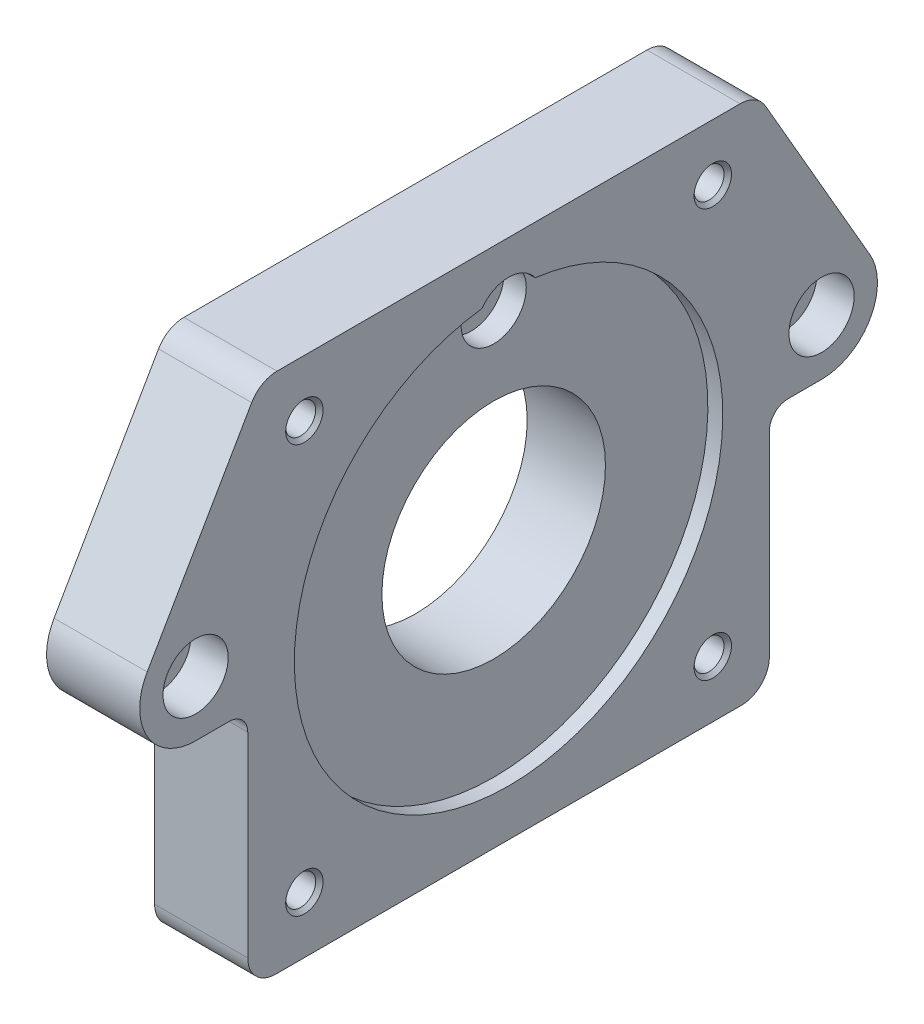
from build123d import *

# Parameters (mm, degrees)
SKETCH1_R                                        = 19.05
BOSS_EXTRUDE1_DEPTH                              = 15.875
FILLET2_R                                        = 3.175
FILLET3_R                                        = 4.7752
SKETCH6_R                                        = 36.5099981
CUT_EXTRUDE2_DEPTH                               = 2.54
CBORE_FOR_1_4_SOCKET_HEAD_CAP_SCREW1_D           = 6.5278
CBORE_FOR_1_4_SOCKET_HEAD_CAP_SCREW1_CBORE_D     = 11.1125
CBORE_FOR_1_4_SOCKET_HEAD_CAP_SCREW1_CBORE_DEPTH = 6.35
F_1_4_20_TAPPED_HOLE1_D                          = 5.1054
F_1_4_20_TAPPED_HOLE1_DEPTH                      = 19.05
F_1_4_20_TAPPED_HOLE1_CSINK_D                    = 6.3754
F_1_4_20_TAPPED_HOLE1_CSINK_ANGLE                = 90
F_1_4_20_TAPPED_HOLE1_TIP                        = 1.533816902


with BuildPart() as part:
    # Sketch1 → Boss-Extrude1 (new body)
    with BuildSketch(Plane(origin=(0, 0, 0), x_dir=(0, 0, -1), z_dir=(1, 0, 0))):
        with BuildLine():
            Line((-39.461181898, 44.45), (39.461181898, 44.45))
            ThreePointArc((39.461181898, 44.45), (41.955590949, 43.781625109), (43.781625109, 41.955590949))
            Line((43.781625109, 41.955590949), (61.588891971, 11.1125))
            ThreePointArc((61.588891971, 11.1125), (61.588891971, 1.5875), (53.34, -3.175))
            Line((53.34, -3.175), (44.45, -3.175))
            Line((44.45, -3.175), (44.45, -44.45))
            Line((44.45, -44.45), (-44.45, -44.45))
            Line((-44.45, -44.45), (-44.45, -3.175))
            Line((-44.45, -3.175), (-53.34, -3.175))
            ThreePointArc((-53.34, -3.175), (-61.588891971, 1.5875), (-61.588891971, 11.1125))
            Line((-61.588891971, 11.1125), (-43.781625109, 41.955590949))
            ThreePointArc((-43.781625109, 41.955590949), (-41.955590949, 43.781625109), (-39.461181898, 44.45))
        make_face()
        Circle(SKETCH1_R, mode=Mode.SUBTRACT)
    extrude(amount=BOSS_EXTRUDE1_DEPTH)

    # Fillet2
    fillet2_edges = [part.edges().sort_by_distance(p)[0] for p in [
        (7.9375, -3.175, 44.45),
        (7.9375, -3.175, -44.45),
    ]]
    fillet(fillet2_edges, radius=FILLET2_R)

    # Fillet3
    fillet3_edges = [part.edges().sort_by_distance(p)[0] for p in [
        (7.9375, -44.45, 44.45),
        (7.9375, -44.45, -44.45),
    ]]
    fillet(fillet3_edges, radius=FILLET3_R)

    # Sketch6 → Cut-Extrude2 (cut)
    with BuildSketch(Plane(origin=(15.875, 0, 0), x_dir=(0, 0, -1), z_dir=(1, 0, 0))):
        Circle(SKETCH6_R)
    extrude(amount=-CUT_EXTRUDE2_DEPTH, mode=Mode.SUBTRACT)

    # CBORE for 1/4 Socket Head Cap Screw1 (through all)
    with Locations(Plane(origin=(15.875, 0, 0), x_dir=(0, 0, -1), z_dir=(1, 0, 0))):
        with Locations((-53.34, 6.35), (53.34, 6.35), (0, 33.02)):
            CounterBoreHole(CBORE_FOR_1_4_SOCKET_HEAD_CAP_SCREW1_D / 2, CBORE_FOR_1_4_SOCKET_HEAD_CAP_SCREW1_CBORE_D / 2, CBORE_FOR_1_4_SOCKET_HEAD_CAP_SCREW1_CBORE_DEPTH)

    # 1/4-20 Tapped Hole1
    with Locations(Plane(origin=(15.875, 0, 0), x_dir=(0, 0, -1), z_dir=(1, 0, 0))):
        with Locations((34.8, -34.8), (-34.8, 34.8), (-34.8, -34.8), (34.8, 34.8)):
            CounterSinkHole(F_1_4_20_TAPPED_HOLE1_D / 2, F_1_4_20_TAPPED_HOLE1_CSINK_D / 2, depth=F_1_4_20_TAPPED_HOLE1_DEPTH, counter_sink_angle=F_1_4_20_TAPPED_HOLE1_CSINK_ANGLE)
            with Locations((0, 0, -(F_1_4_20_TAPPED_HOLE1_DEPTH + F_1_4_20_TAPPED_HOLE1_TIP / 2))):  # 118° drill point
                Cone(0, F_1_4_20_TAPPED_HOLE1_D / 2, F_1_4_20_TAPPED_HOLE1_TIP, mode=Mode.SUBTRACT)


solid = part.part
